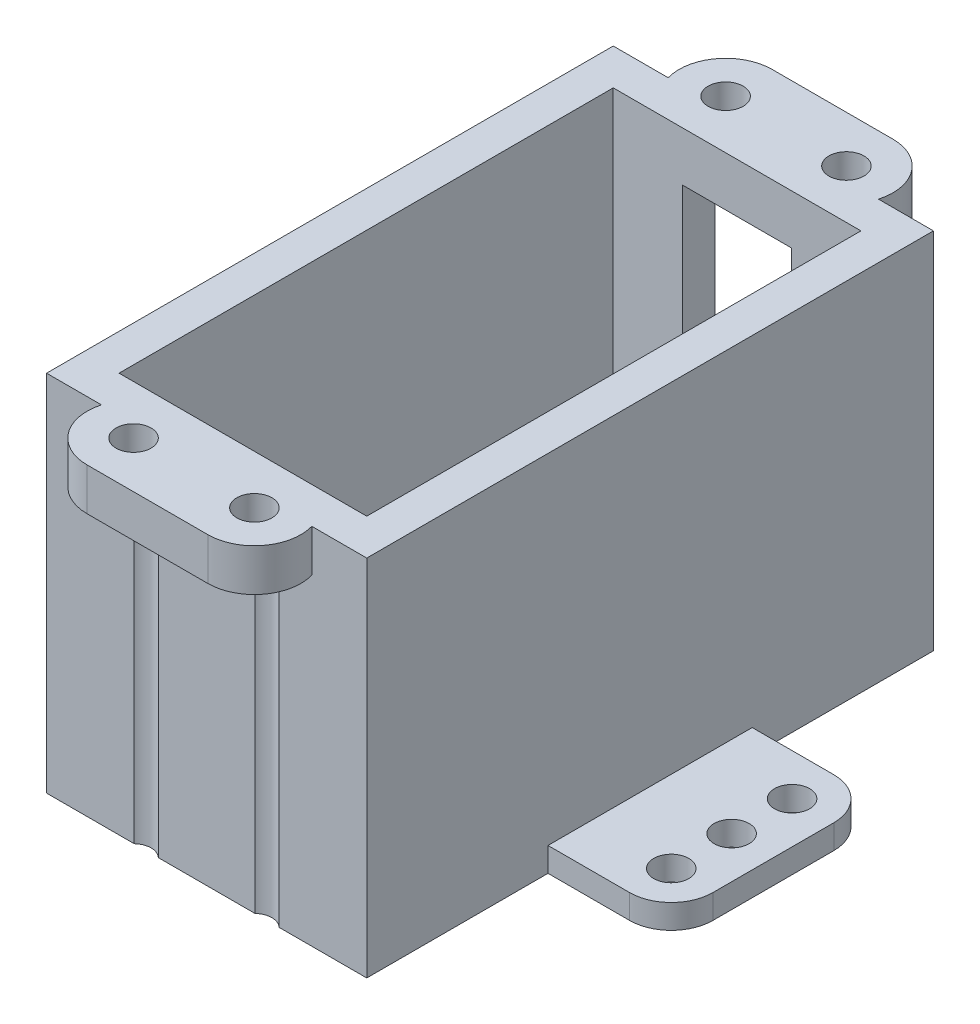
from build123d import *

# Parameters (mm, degrees)
CROQUIS2_R              = 1.45
SALIENTE_EXTRUIR1_DEPTH = 2
CROQUIS3_W              = 26.5
CROQUIS3_H              = 46.9
CROQUIS3_W_2            = 20.5
CROQUIS3_H_2            = 40.9
SALIENTE_EXTRUIR2_DEPTH = 28.1
SALIENTE_EXTRUIR3_DEPTH = 3.5
CROQUIS5_R              = 1.45
CORTAR_EXTRUIR1_DEPTH   = 48.534565862
CROQUIS6_W              = 9
CROQUIS6_H              = 24
CORTAR_EXTRUIR2_DEPTH   = 3.5


with BuildPart() as part:
    # Croquis2 → Saliente-Extruir1 (new body)
    with BuildSketch(Plane(origin=(0, 0, 0), x_dir=(1, 0, 0), z_dir=(0, 1, 0))):
        with BuildLine():
            Line((-23.45, 5), (-23.45, -5))
            ThreePointArc((-23.45, -5), (-22.439518395, -7.439518395), (-20, -8.45))
            Line((-20, -8.45), (-13.25, -8.45))
            Line((-13.25, -8.45), (-13.25, -23.45))
            Line((-13.25, -23.45), (13.25, -23.45))
            Line((13.25, -23.45), (13.25, -8.45))
            Line((13.25, -8.45), (20, -8.45))
            ThreePointArc((20, -8.45), (22.439518395, -7.439518395), (23.45, -5))
            Line((23.45, -5), (23.45, 5))
            ThreePointArc((23.45, 5), (22.439518395, 7.439518395), (20, 8.45))
            Line((20, 8.45), (13.25, 8.45))
            Line((13.25, 8.45), (13.25, 23.45))
            Line((13.25, 23.45), (-13.25, 23.45))
            Line((-13.25, 23.45), (-13.25, 8.45))
            Line((-13.25, 8.45), (-20, 8.45))
            ThreePointArc((-20, 8.45), (-22.439518395, 7.439518395), (-23.45, 5))
        make_face()
        with Locations(Location((-20, 5, 0), (0, 0, 270))):
            Circle(CROQUIS2_R, mode=Mode.SUBTRACT)
        with Locations(Location((-20, -5, 0), (0, 0, 90))):
            Circle(CROQUIS2_R, mode=Mode.SUBTRACT)
        with Locations(Location((20, -5, 0), (0, 0, 270))):
            Circle(CROQUIS2_R, mode=Mode.SUBTRACT)
        with Locations(Location((20, 5, 0), (0, 0, 90))):
            Circle(CROQUIS2_R, mode=Mode.SUBTRACT)
        with Locations(Location((-20, 0, 0), (0, 0, 270))):
            Circle(CROQUIS2_R, mode=Mode.SUBTRACT)
        with Locations(Location((20, 0, 0), (0, 0, 90))):
            Circle(CROQUIS2_R, mode=Mode.SUBTRACT)
    extrude(amount=SALIENTE_EXTRUIR1_DEPTH)

    # Croquis3 → Saliente-Extruir2 (add)
    with BuildSketch(Plane(origin=(0, 2, 0), x_dir=(1, 0, 0), z_dir=(0, 1, 0))):
        Rectangle(CROQUIS3_W, CROQUIS3_H)
        Rectangle(CROQUIS3_W_2, CROQUIS3_H_2, mode=Mode.SUBTRACT)
    extrude(amount=SALIENTE_EXTRUIR2_DEPTH)

    # Croquis4 → Saliente-Extruir3 (add)
    with BuildSketch(Plane(origin=(0, 30.1, 0), x_dir=(1, 0, 0), z_dir=(0, 1, 0))):
        with BuildLine():
            Line((-5, 28.348235425), (5, 28.348235425))
            ThreePointArc((5, 28.348235425), (8.069980707, 26.820373751), (8.702217698, 23.45))
            Line((8.702217698, 23.45), (-8.702217698, 23.45))
            ThreePointArc((-8.702217698, 23.45), (-8.069980707, 26.820373751), (-5, 28.348235425))
        make_face()
        with BuildLine():
            Line((-8.702217698, -23.45), (8.702217698, -23.45))
            ThreePointArc((8.702217698, -23.45), (8.069980707, -26.820373751), (5, -28.348235425))
            Line((5, -28.348235425), (-5, -28.348235425))
            ThreePointArc((-5, -28.348235425), (-8.069980707, -26.820373751), (-8.702217698, -23.45))
        make_face()
    extrude(amount=-SALIENTE_EXTRUIR3_DEPTH)

    # Croquis5 → Cortar-Extruir1 (cut, through all)
    with BuildSketch(Plane(origin=(0, 30.1, 0), x_dir=(1, 0, 0), z_dir=(0, 1, 0))):
        with Locations(Location((-5, 24.5, 0), (0, 0, 270))):
            Circle(CROQUIS5_R)
        with Locations(Location((5, 24.5, 0), (0, 0, 313.602818973))):
            Circle(CROQUIS5_R)
        with Locations(Location((5, -24.5, 0), (0, 0, 270))):
            Circle(CROQUIS5_R)
        with Locations(Location((-5, -24.5, 0), (0, 0, 133.602818973))):
            Circle(CROQUIS5_R)
    extrude(amount=-CORTAR_EXTRUIR1_DEPTH, mode=Mode.SUBTRACT)

    # Croquis6 → Cortar-Extruir2 (cut)
    with BuildSketch(Plane(origin=(0, 0, -23.45), x_dir=(-1, 0, 0), z_dir=(0, 0, -1))):
        with Locations((0, 14)):
            Rectangle(CROQUIS6_W, CROQUIS6_H)
    extrude(amount=-CORTAR_EXTRUIR2_DEPTH, mode=Mode.SUBTRACT)


solid = part.part
